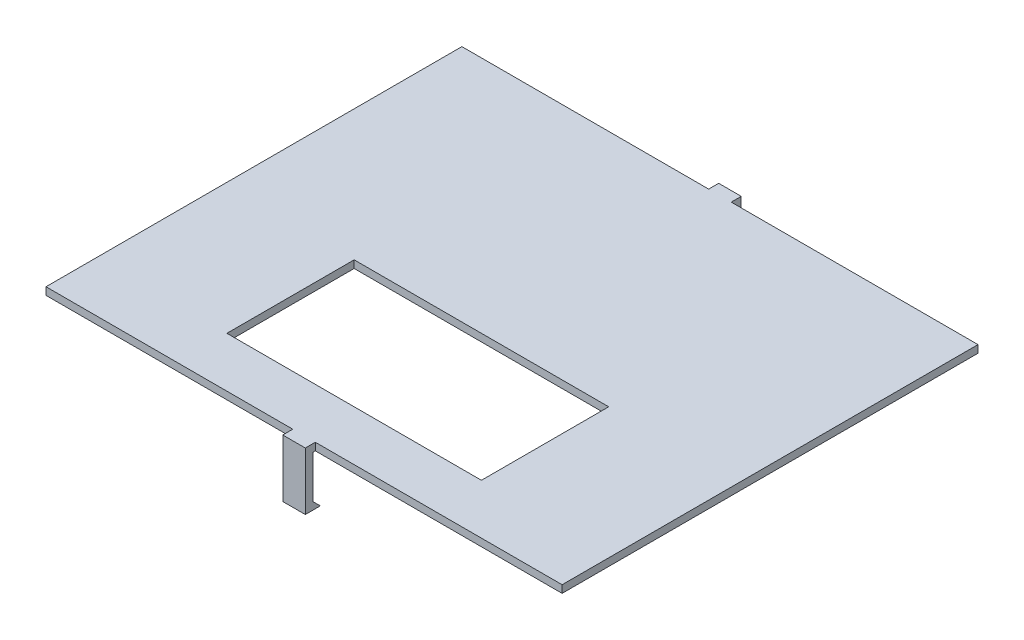
from build123d import *

# Parameters (mm, degrees)
SKETCH1_W           = 103
SKETCH1_H           = 83
BOSS_EXTRUDE1_DEPTH = 1.5
BOSS_EXTRUDE2_DEPTH = 2.25
SKETCH3_W           = 50.8
SKETCH3_H           = 25.4
CUT_EXTRUDE1_DEPTH  = 1.5


with BuildPart() as part:
    # Sketch1 → Boss-Extrude1 (new body)
    with BuildSketch(Plane(origin=(0, 0, 0), x_dir=(1, 0, 0), z_dir=(0, 1, 0))):
        with Locations((18.292349727, -12.091530055)):
            Rectangle(SKETCH1_W, SKETCH1_H)
    extrude(amount=BOSS_EXTRUDE1_DEPTH)

    # Sketch2 → Boss-Extrude2 (add, symmetric)
    with BuildSketch(Plane(origin=(18.292349727, 0, 0), x_dir=(0, 0, -1), z_dir=(1, 0, 0))):
        Polygon((-53.591530055, 1.5), (-55.591530055, 1.5), (-55.591530055, -10), (-52.592463679, -10), (-54.091530055, -8.500933624), (-54.091530055, 0), (-53.591530055, 0), align=None)
        Polygon((29.408469945, 0), (29.408469945, 1.5), (31.408469945, 1.5), (31.408469945, -10), (28.409403569, -10), (29.908469945, -8.500933624), (29.908469945, 0), align=None)
    extrude(amount=BOSS_EXTRUDE2_DEPTH, both=True)

    # Sketch3 → Cut-Extrude1 (cut)
    with BuildSketch(Plane(origin=(0, 1.5, 0), x_dir=(1, 0, 0), z_dir=(0, 1, 0))):
        with Locations((18.292349727, -30.891530055)):
            Rectangle(SKETCH3_W, SKETCH3_H)
    extrude(amount=-CUT_EXTRUDE1_DEPTH, mode=Mode.SUBTRACT)


solid = part.part
